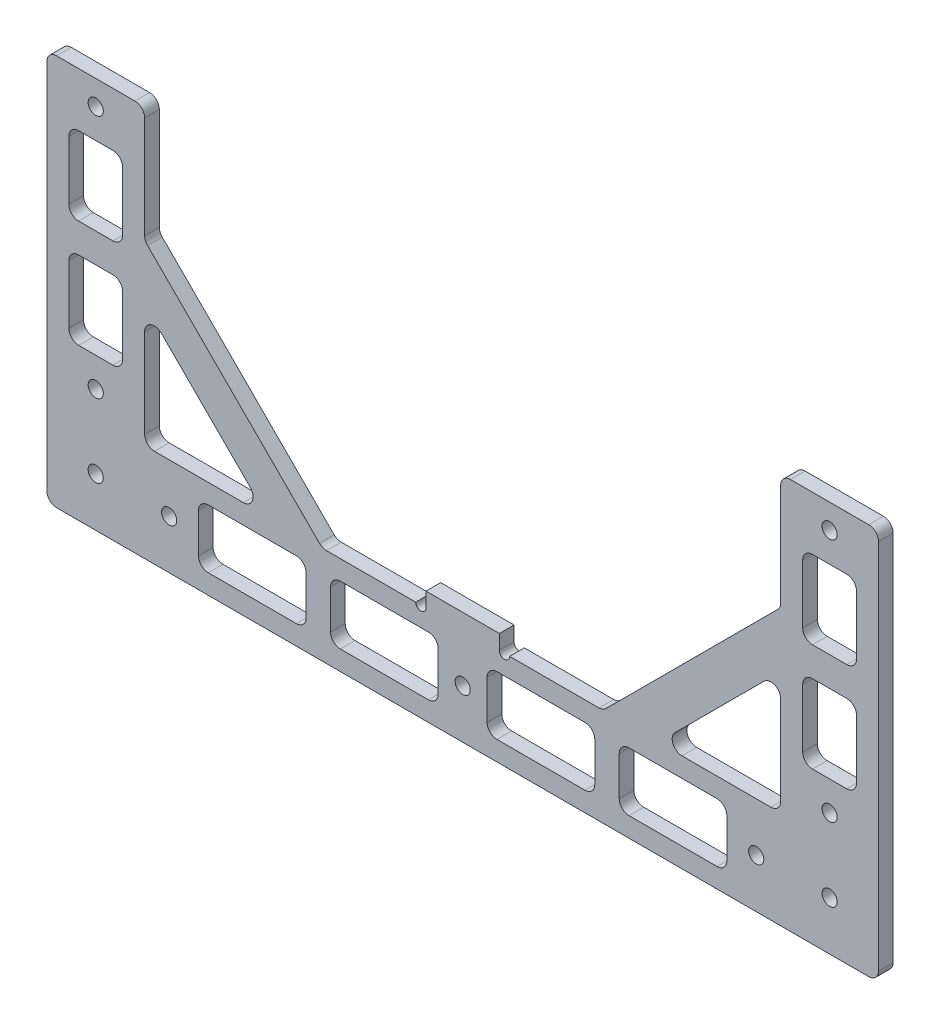
from build123d import *

# Parameters (mm, degrees)
SKETCH_1_R      = 1.55
SKETCH_1_W      = 22
SKETCH_1_H      = 12
SKETCH_1_W_2    = 11
SKETCH_1_H_2    = 16
EXTRUDE_1_DEPTH = 3
FILLET_1_R      = 2


with BuildPart() as part:
    # 草图1 → 凸台-拉伸1 (new body)
    with BuildSketch(Plane.XY):
        with BuildLine():
            Line((0, 80), (0, 0))
            Line((0, 0), (170, 0))
            Line((170, 0), (170, 80))
            Line((170, 80), (150, 80))
            Line((150, 80), (150, 56.313708499))
            Line((150, 56.313708499), (113.686291501, 20))
            Line((113.686291501, 20), (94.6, 20))
            ThreePointArc((94.6, 20), (93.55, 18.95), (92.5, 20))
            Line((92.5, 20), (92.5, 23))
            Line((92.5, 23), (77.5, 23))
            Line((77.5, 23), (77.5, 20))
            ThreePointArc((77.5, 20), (76.45, 18.95), (75.4, 20))
            Line((75.4, 20), (56.313708499, 20))
            Line((56.313708499, 20), (20, 56.313708499))
            Line((20, 56.313708499), (20, 80))
            Line((20, 80), (0, 80))
        make_face()
        with Locations((10, 10)):
            Circle(SKETCH_1_R, mode=Mode.SUBTRACT)
        with Locations((25, 10)):
            Circle(SKETCH_1_R, mode=Mode.SUBTRACT)
        with Locations((42, 10)):
            Rectangle(SKETCH_1_W, SKETCH_1_H, mode=Mode.SUBTRACT)
        with Locations((69, 10)):
            Rectangle(SKETCH_1_W, SKETCH_1_H, mode=Mode.SUBTRACT)
        with Locations((10, 25)):
            Circle(SKETCH_1_R, mode=Mode.SUBTRACT)
        with Locations((10, 39)):
            Rectangle(SKETCH_1_W_2, SKETCH_1_H_2, mode=Mode.SUBTRACT)
        Polygon((45, 20), (20, 20), (20, 45), align=None, mode=Mode.SUBTRACT)
        with Locations((85, 10)):
            Circle(SKETCH_1_R, mode=Mode.SUBTRACT)
        with Locations((101, 10)):
            Rectangle(SKETCH_1_W, SKETCH_1_H, mode=Mode.SUBTRACT)
        with Locations((145, 10)):
            Circle(SKETCH_1_R, mode=Mode.SUBTRACT)
        with Locations((160, 10)):
            Circle(SKETCH_1_R, mode=Mode.SUBTRACT)
        with Locations((128, 10)):
            Rectangle(SKETCH_1_W, SKETCH_1_H, mode=Mode.SUBTRACT)
        with Locations((160, 25)):
            Circle(SKETCH_1_R, mode=Mode.SUBTRACT)
        Polygon((150, 45), (150, 20), (125, 20), align=None, mode=Mode.SUBTRACT)
        with Locations((160, 39)):
            Rectangle(SKETCH_1_W_2, SKETCH_1_H_2, mode=Mode.SUBTRACT)
        with Locations((10, 61)):
            Rectangle(SKETCH_1_W_2, SKETCH_1_H_2, mode=Mode.SUBTRACT)
        with Locations((10, 75)):
            Circle(SKETCH_1_R, mode=Mode.SUBTRACT)
        with Locations((160, 61)):
            Rectangle(SKETCH_1_W_2, SKETCH_1_H_2, mode=Mode.SUBTRACT)
        with Locations((160, 75)):
            Circle(SKETCH_1_R, mode=Mode.SUBTRACT)
    extrude(amount=EXTRUDE_1_DEPTH)

    # 圆角1
    fillet_1_edges = [part.edges().sort_by_distance(p)[0] for p in [
        (150, 20, 1.5),
        (150, 45, 1.5),
        (125, 20, 1.5),
        (20, 20, 1.5),
        (45, 20, 1.5),
        (20, 45, 1.5),
        (15.5, 31, 1.5),
        (15.5, 47, 1.5),
        (4.5, 47, 1.5),
        (4.5, 31, 1.5),
        (15.5, 53, 1.5),
        (15.5, 69, 1.5),
        (4.5, 69, 1.5),
        (4.5, 53, 1.5),
        (165.5, 31, 1.5),
        (165.5, 47, 1.5),
        (154.5, 47, 1.5),
        (154.5, 31, 1.5),
        (165.5, 53, 1.5),
        (165.5, 69, 1.5),
        (154.5, 69, 1.5),
        (154.5, 53, 1.5),
        (53, 4, 1.5),
        (53, 16, 1.5),
        (31, 16, 1.5),
        (31, 4, 1.5),
        (80, 4, 1.5),
        (80, 16, 1.5),
        (58, 16, 1.5),
        (58, 4, 1.5),
        (139, 4, 1.5),
        (139, 16, 1.5),
        (117, 16, 1.5),
        (117, 4, 1.5),
        (112, 4, 1.5),
        (112, 16, 1.5),
        (90, 16, 1.5),
        (90, 4, 1.5),
        (113.686291501, 20, 1.5),
        (150, 56.313708499, 1.5),
        (150, 80, 1.5),
        (170, 80, 1.5),
        (170, 0, 1.5),
        (0, 0, 1.5),
        (0, 80, 1.5),
        (20, 80, 1.5),
        (20, 56.313708499, 1.5),
        (56.313708499, 20, 1.5),
    ]]
    fillet(fillet_1_edges, radius=FILLET_1_R)


solid = part.part
